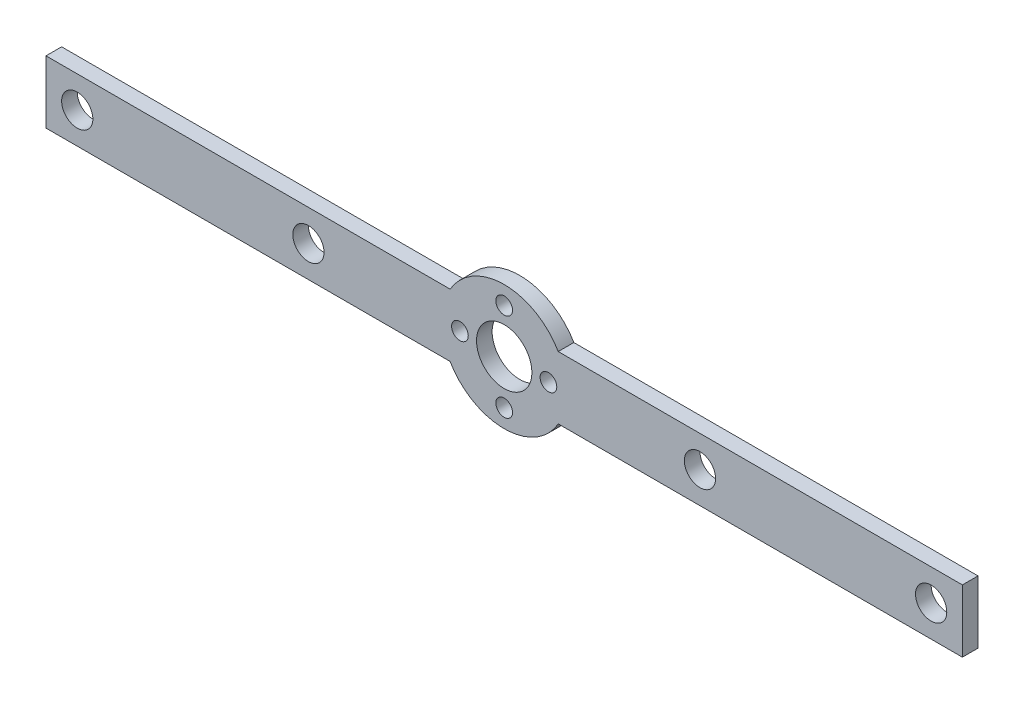
from build123d import *

# Parameters (mm, degrees)
SKETCH_2_R      = 1.5
SKETCH_2_R_2    = 0.8
SKETCH_2_R_3    = 2.66
EXTRUDE_1_DEPTH = 1.5


with BuildPart() as part:
    # 草图2 → 凸台-拉伸1 (new body)
    with BuildSketch(Plane.XY):
        with BuildLine():
            Line((5.188427748, -15.986660076), (44, -15.986660076))
            Line((44, -15.986660076), (44, -22))
            Line((44, -22), (5.196152423, -22))
            ThreePointArc((5.196152423, -22), (0, -25), (-5.196152423, -22))
            Line((-5.196152423, -22), (-44, -22))
            Line((-44, -22), (-44, -15.986660076))
            Line((-44, -15.986660076), (-5.188427748, -15.986660076))
            ThreePointArc((-5.188427748, -15.986660076), (0, -13), (5.188427748, -15.986660076))
        make_face()
        with Locations((41, -19)):
            Circle(SKETCH_2_R, mode=Mode.SUBTRACT)
        with Locations((-41, -19)):
            Circle(SKETCH_2_R, mode=Mode.SUBTRACT)
        with Locations((4.25, -19)):
            Circle(SKETCH_2_R_2, mode=Mode.SUBTRACT)
        with Locations((-4.25, -19)):
            Circle(SKETCH_2_R_2, mode=Mode.SUBTRACT)
        with Locations((0, -14.75)):
            Circle(SKETCH_2_R_2, mode=Mode.SUBTRACT)
        with Locations((0, -23.25)):
            Circle(SKETCH_2_R_2, mode=Mode.SUBTRACT)
        with Locations((0, -19)):
            Circle(SKETCH_2_R_3, mode=Mode.SUBTRACT)
        with Locations((-18.8, -19)):
            Circle(SKETCH_2_R, mode=Mode.SUBTRACT)
        with Locations((18.8, -19)):
            Circle(SKETCH_2_R, mode=Mode.SUBTRACT)
    extrude(amount=EXTRUDE_1_DEPTH)


solid = part.part
